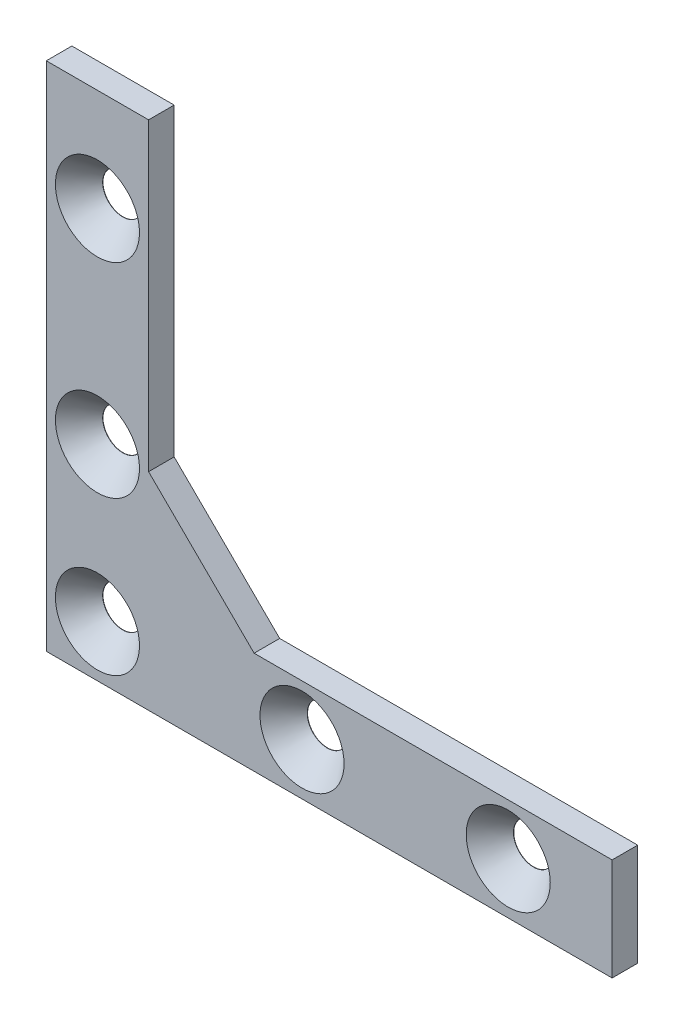
from build123d import *

# Parameters (mm, degrees)
BOSS_EXTRUDE1_DEPTH             = 3.175
F_10_CLEARANCE_HOLE1_AT_2_COUNT = 2
F_10_CLEARANCE_HOLE1_AT_2_PITCH = 19.05
F_10_CLEARANCE_HOLE1_AT_3_COUNT = 2
F_10_CLEARANCE_HOLE1_AT_3_PITCH = 44.411770585
F_10_CLEARANCE_HOLE1_AT_4_COUNT = 2
F_10_CLEARANCE_HOLE1_AT_4_PITCH = 25.4
F_10_CLEARANCE_HOLE1_AT_5_COUNT = 2
F_10_CLEARANCE_HOLE1_AT_5_PITCH = 51.001683504


with BuildPart() as part:
    # Sketch1 → Boss-Extrude1 (new body)
    with BuildSketch(Plane.XY):
        Polygon((-260.350000508, 0), (-273.453367516, 0), (-273.453367516, 63.5), (-260.753367516, 63.5), (-260.753367516, 25.666043074), (-247.650000508, 12.7), (-203.200000508, 12.7), (-203.200000508, 0), align=None)
    extrude(amount=BOSS_EXTRUDE1_DEPTH)

    # Sketch4 → #10 Clearance Hole1 (revolve, cut)
    with BuildSketch(Plane(origin=(-267.103367516, 6.388229415, 3.175), x_dir=(0, -1, 0), z_dir=(1, 0, 0))):
        Polygon((0, 0), (0, 3.175), (2.4892, 3.175), (2.4892, 3.141080936), (5.2197, 0), align=None)
    f_10_clearance_hole1 = revolve(axis=Axis((-267.103367516, 6.388229415, 9.525), (0, 0, -1)), mode=Mode.SUBTRACT)

    # #10 Clearance Hole1 at 2: #10 Clearance Hole1 ×2
    with Locations(*[(0, i * F_10_CLEARANCE_HOLE1_AT_2_PITCH, 0) for i in range(1, F_10_CLEARANCE_HOLE1_AT_2_COUNT)]):
        add(f_10_clearance_hole1, mode=Mode.SUBTRACT)

    # #10 Clearance Hole1 at 3: #10 Clearance Hole1 ×2
    with Locations(*[(0, i * F_10_CLEARANCE_HOLE1_AT_3_PITCH, 0) for i in range(1, F_10_CLEARANCE_HOLE1_AT_3_COUNT)]):
        add(f_10_clearance_hole1, mode=Mode.SUBTRACT)

    # #10 Clearance Hole1 at 4: #10 Clearance Hole1 ×2
    with Locations(*[(i * F_10_CLEARANCE_HOLE1_AT_4_PITCH, 0, 0) for i in range(1, F_10_CLEARANCE_HOLE1_AT_4_COUNT)]):
        add(f_10_clearance_hole1, mode=Mode.SUBTRACT)

    # #10 Clearance Hole1 at 5: #10 Clearance Hole1 ×2
    with Locations(*[(i * F_10_CLEARANCE_HOLE1_AT_5_PITCH, 0, 0) for i in range(1, F_10_CLEARANCE_HOLE1_AT_5_COUNT)]):
        add(f_10_clearance_hole1, mode=Mode.SUBTRACT)


solid = part.part
